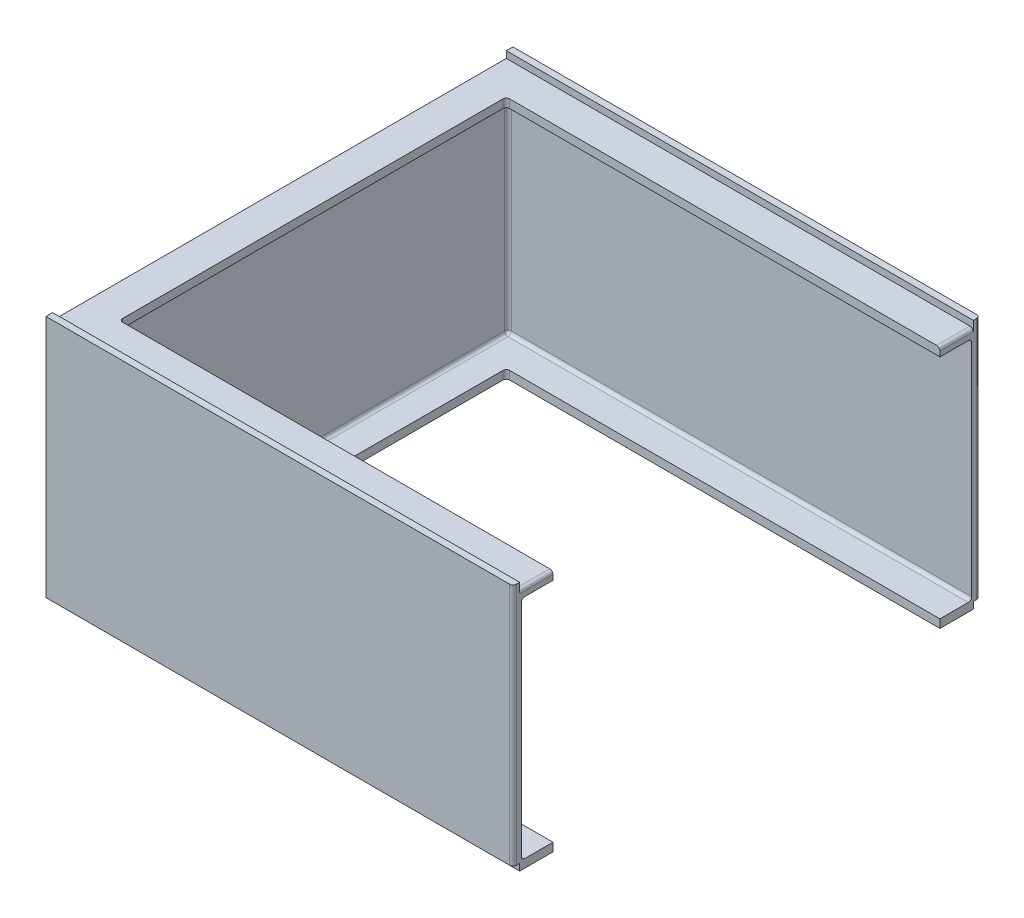
from build123d import *

# Parameters (mm, degrees)
SKETCH_1_W          = 280
SKETCH_1_H          = 280
EXTRUDE_1_DEPTH     = 150
SKETCH_2_W          = 280
SKETCH_2_H          = 272
CUT_EXTRUDE_1_DEPTH = 4
SKETCH_3_W          = 280
SKETCH_3_H          = 4
CUT_EXTRUDE_2_DEPTH = 4
SKETCH_4_W          = 270
SKETCH_4_H          = 136
CUT_EXTRUDE_3_DEPTH = 278
SKETCH_6_W          = 260
SKETCH_6_H          = 232
CUT_EXTRUDE_7_DEPTH = 247
FILLET_4_R          = 2
FILLET_5_R          = 2
FILLET_6_R          = 2
FILLET_7_R          = 2


with BuildPart() as part:
    # 草图1 → 凸台-拉伸1 (new body)
    with BuildSketch(Plane(origin=(0, 0, 0), x_dir=(1, 0, 0), z_dir=(0, 1, 0))):
        Rectangle(SKETCH_1_W, SKETCH_1_H)
    extrude(amount=EXTRUDE_1_DEPTH)

    # 草图2 → 切除-拉伸1 (cut)
    with BuildSketch(Plane(origin=(0, 150, 0), x_dir=(1, 0, 0), z_dir=(0, 1, 0))):
        Rectangle(SKETCH_2_W, SKETCH_2_H)
    extrude(amount=-CUT_EXTRUDE_1_DEPTH, mode=Mode.SUBTRACT)

    # 草图3 → 切除-拉伸2 (cut)
    with BuildSketch(Plane.XZ):
        with Locations((0, 138)):
            Rectangle(SKETCH_3_W, SKETCH_3_H)
        with Locations((0, -138)):
            Rectangle(SKETCH_3_W, SKETCH_3_H)
    extrude(amount=-CUT_EXTRUDE_2_DEPTH, mode=Mode.SUBTRACT)

    # 草图4 → 切除-拉伸3 (cut)
    with BuildSketch(Plane(origin=(140, 0, 0), x_dir=(0, 0, -1), z_dir=(1, 0, 0))):
        with Locations((0, 73)):
            Rectangle(SKETCH_4_W, SKETCH_4_H)
    extrude(amount=-CUT_EXTRUDE_3_DEPTH, mode=Mode.SUBTRACT)

    # 草图6 → 切除-拉伸7 (cut, through all)
    with BuildSketch(Plane(origin=(0, 146, 0), x_dir=(1, 0, 0), z_dir=(0, 1, 0))):
        with Locations((10, 0)):
            Rectangle(SKETCH_6_W, SKETCH_6_H)
    extrude(amount=-CUT_EXTRUDE_7_DEPTH, mode=Mode.SUBTRACT)

    # 圆角4
    fillet_4_edges = [part.edges().sort_by_distance(p)[0] for p in [
        (140, 77, -140),
        (140, 77, 140),
    ]]
    fillet(fillet_4_edges, radius=FILLET_4_R)

    # 圆角5
    fillet_5_edges = [part.edges().sort_by_distance(p)[0] for p in [
        (140, 146, 126),
        (140, 146, -126),
    ]]
    fillet(fillet_5_edges, radius=FILLET_5_R)

    # 圆角6
    fillet_6_edges = [part.edges().sort_by_distance(p)[0] for p in [
        (-120, 143.5, 116),
        (-120, 2.5, 116),
        (-120, 143.5, -116),
        (-120, 2.5, -116),
    ]]
    fillet(fillet_6_edges, radius=FILLET_6_R)

    # 圆角7
    fillet_7_edges = [part.edges().sort_by_distance(p)[0] for p in [
        (1, 5, 135),
        (1, 141, 135),
        (1, 141, -135),
        (1, 5, -135),
        (-138, 73, 135),
        (-138, 141, 0),
        (-138, 73, -135),
        (-138, 5, 0),
    ]]
    fillet(fillet_7_edges, radius=FILLET_7_R)


solid = part.part
